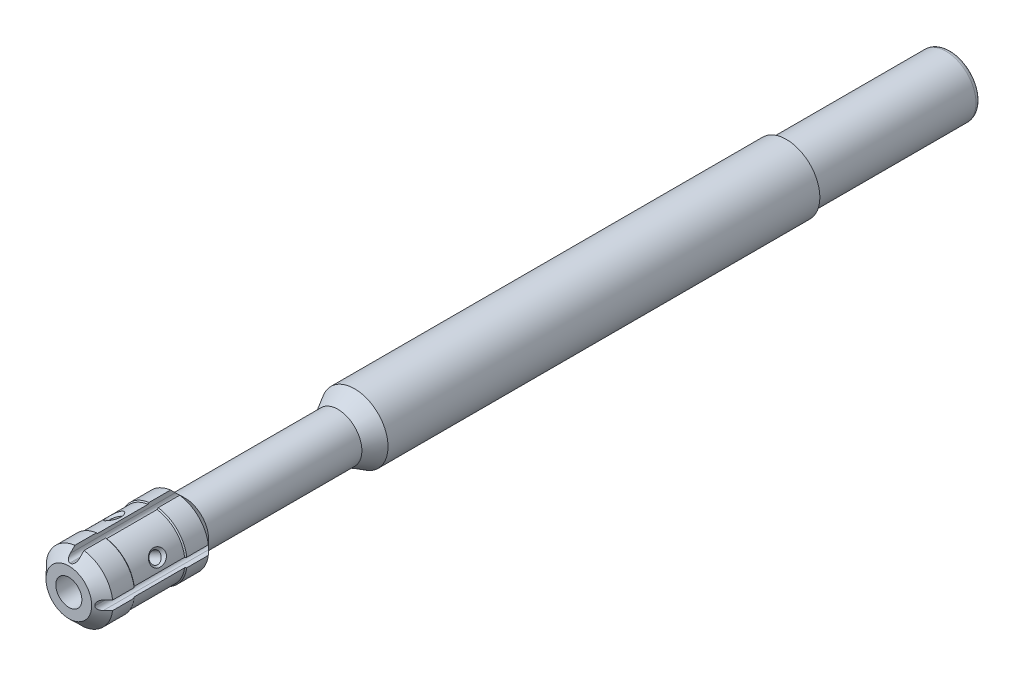
from build123d import *

# Parameters (mm, degrees)
CUT_EXTRUDE2_REACH = 95.81
CIRPATTERN1_COUNT  = 4
CIRPATTERN2_COUNT  = 2
CIRPATTERN2_ANGLE  = 90
FILLET1_R          = 0.508


with BuildPart() as part:
    # Sketch5 → Revolve1 (revolve)
    with BuildSketch(Plane(origin=(0, 0, 0), x_dir=(0, 0, -1), z_dir=(1, 0, 0))):
        Polygon((-72.6694, 3.4417), (-67.31, 3.4417), (-67.1957, 3.556), (-64.9097, 3.556), (-63.8937, 2.54), (-47.61946362, 2.54), (-45.8597, 3.556), (0, 3.556), (0, 3.175), (17.4752, 3.175), (17.4752, 0), (-67.450574022, 0), (-68.2498, 1.3843), (-76.2, 1.3843), (-76.2, 2.4257), (-75.0697, 3.556), (-72.7837, 3.556), align=None)
    revolve(axis=Axis((0, 0, -31.364395506), (0, 0, 1)))

    # Sketch13 → Cut-Extrude2 (cut, up to next)
    with BuildSketch(Plane.XY.offset(76.2), mode=Mode.PRIVATE) as cut_extrude2_sk1:
        with BuildLine():
            Line((0.4826, 3.992062481), (0.4826, 3.0226))
            ThreePointArc((0.4826, 3.0226), (0.356128708, 2.717271292), (0.0508, 2.5908))
            Line((0.0508, 2.5908), (-0.0508, 2.5908))
            ThreePointArc((-0.0508, 2.5908), (-0.356128708, 2.717271292), (-0.4826, 3.0226))
            Line((-0.4826, 3.0226), (-0.4826, 3.992062481))
            Line((-0.4826, 3.992062481), (0.4826, 3.992062481))
        make_face()
    cut_extrude2_tool1 = extrude(cut_extrude2_sk1.sketch, amount=-CUT_EXTRUDE2_REACH, mode=Mode.PRIVATE) & part.part
    cut_extrude2 = cut_extrude2_tool1.solids().sort_by_distance((0, 3.329428, 76.2))[0]
    add(cut_extrude2, mode=Mode.SUBTRACT)

    # CirPattern1: Cut-Extrude2 ×4 about axis
    cirpattern1_axis = Axis((0, 0, 0), (0, 0, 1))
    for i in range(1, CIRPATTERN1_COUNT):
        add(cut_extrude2.rotate(cirpattern1_axis, i * 360 / CIRPATTERN1_COUNT), mode=Mode.SUBTRACT)

    # Sketch14 → Cut-Revolve1 (revolve, cut)
    with BuildSketch(Plane.XY.offset(69.85)):
        Polygon((3.712808322, 1.891770329), (-3.712808322, -1.891770329), (-2.980567045, -3.328874752), (-2.536558764, -1.962357776), (3.078532622, 0.898674187), (4.445049599, 0.454665906), align=None)
    cut_revolve1 = revolve(axis=Axis((3.712808322, 1.891770329, 69.85), (0.8910065241883682, 0.45399049973954614, 0)), mode=Mode.SUBTRACT)

    # CirPattern2: Cut-Revolve1 ×2 about axis
    cirpattern2_axis = Axis((0, 0, -4.749201346), (0, 0, 1))
    for i in range(1, CIRPATTERN2_COUNT):
        add(cut_revolve1.rotate(cirpattern2_axis, i * CIRPATTERN2_ANGLE / (CIRPATTERN2_COUNT - 1)), mode=Mode.SUBTRACT)

    # Fillet1
    fillet1_edges = [part.edges().sort_by_distance(p)[0] for p in [
        (0, -3.175, -17.4752),
    ]]
    fillet(fillet1_edges, radius=FILLET1_R)


solid = part.part
